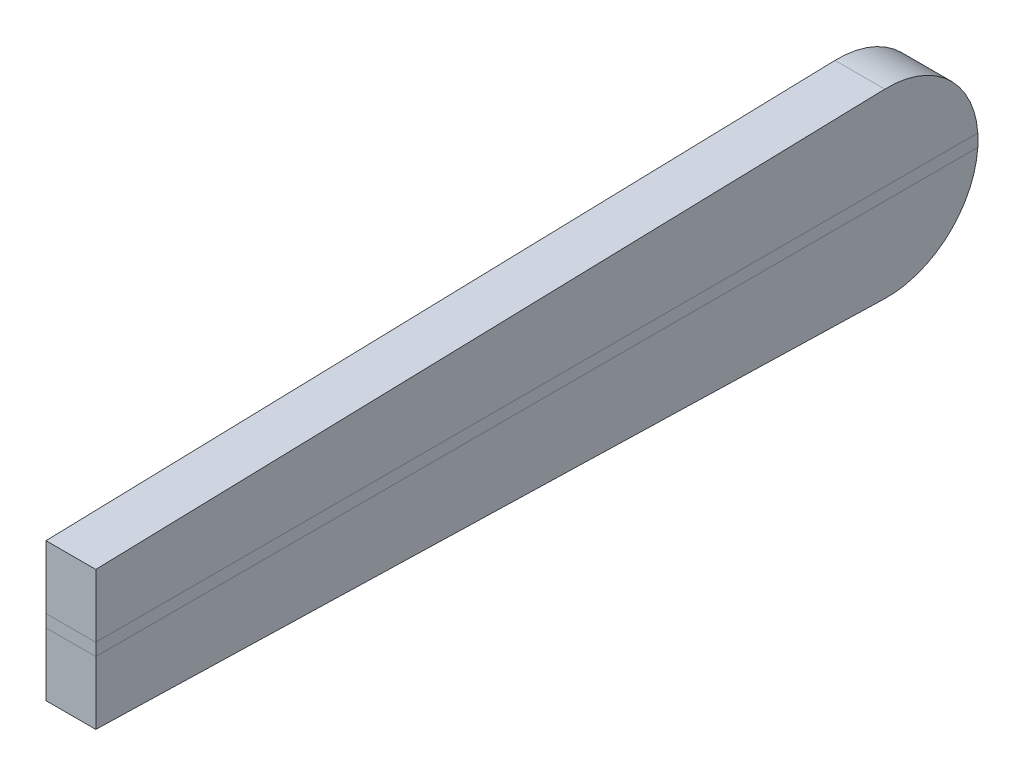
from build123d import *

# Parameters (mm, degrees)
SALIENTE_EXTRUIR2_DEPTH = 11.22


with BuildPart() as part:
    # Croquis5 → Saliente-Extruir2 (new body)
    with BuildSketch(Plane.YZ):
        with BuildLine():
            Line((-15.615, 99.415), (15.615, 99.415))
            Line((15.615, 99.415), (20.447450712, -78.404316288))
            ThreePointArc((20.447450712, -78.404316288), (0, -99.415), (-20.447450712, -78.404316288))
            Line((-20.447450712, -78.404316288), (-15.615, 99.415))
        make_face()
    extrude(amount=SALIENTE_EXTRUIR2_DEPTH)


solid = part.part
